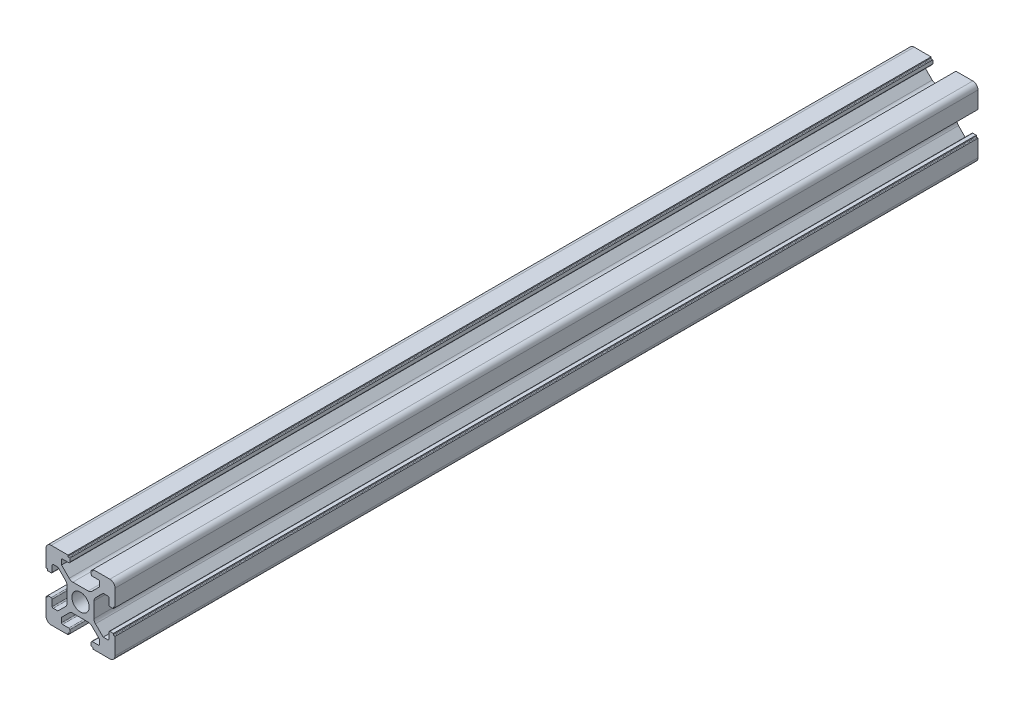
from build123d import *

# Parameters (mm, degrees)
SKETCH_1_R      = 2.5
EXTRUDE_1_DEPTH = 250


with BuildPart() as part:
    # 草图1 → 凸台-拉伸1 (new body)
    with BuildSketch(Plane.XY):
        with BuildLine():
            Line((4.215995631, 3.244230202), (6.436655803, 5.464890373))
            Line((6.436655803, 5.464890373), (7.776655803, 5.464890373))
            ThreePointArc((7.776655803, 5.464890373), (7.988787838, 5.377022408), (8.076655803, 5.164890373))
            Line((8.076655803, 5.164890373), (8.076655803, 3.364890373))
            ThreePointArc((8.076655803, 3.364890373), (8.164523769, 3.152758339), (8.376655803, 3.064890373))
            Line((8.376655803, 3.064890373), (9.376655803, 3.064890373))
            Line((9.376655803, 3.064890373), (9.376655803, 3.364890373))
            ThreePointArc((9.376655803, 3.364890373), (9.435234447, 3.50631173), (9.576655803, 3.564890373))
            Line((9.576655803, 3.564890373), (9.876655803, 3.564890373))
            Line((9.876655803, 3.564890373), (9.876655803, 8.464890373))
            ThreePointArc((9.876655803, 8.464890373), (9.437315975, 9.525550545), (8.376655803, 9.964890373))
            Line((8.376655803, 9.964890373), (3.476655803, 9.964890373))
            Line((3.476655803, 9.964890373), (3.476655803, 9.664890373))
            ThreePointArc((3.476655803, 9.664890373), (3.418077159, 9.523469017), (3.276655803, 9.464890373))
            Line((3.276655803, 9.464890373), (2.976655803, 9.464890373))
            Line((2.976655803, 9.464890373), (2.976655803, 8.464890373))
            ThreePointArc((2.976655803, 8.464890373), (3.064523769, 8.252758339), (3.276655803, 8.164890373))
            Line((3.276655803, 8.164890373), (5.076655803, 8.164890373))
            ThreePointArc((5.076655803, 8.164890373), (5.288787838, 8.077022408), (5.376655803, 7.864890373))
            Line((5.376655803, 7.864890373), (5.376655803, 6.524890373))
            Line((5.376655803, 6.524890373), (3.155995631, 4.304230202))
            ThreePointArc((3.155995631, 4.304230202), (2.669360608, 3.979071075), (2.09533546, 3.864890373))
            Line((2.09533546, 3.864890373), (-2.342023853, 3.864890373))
            ThreePointArc((-2.342023853, 3.864890373), (-2.916049002, 3.979071075), (-3.402684025, 4.304230202))
            Line((-3.402684025, 4.304230202), (-5.623344197, 6.524890373))
            Line((-5.623344197, 6.524890373), (-5.623344197, 7.864890373))
            ThreePointArc((-5.623344197, 7.864890373), (-5.535476231, 8.077022408), (-5.323344197, 8.164890373))
            Line((-5.323344197, 8.164890373), (-3.523344197, 8.164890373))
            ThreePointArc((-3.523344197, 8.164890373), (-3.311212162, 8.252758339), (-3.223344197, 8.464890373))
            Line((-3.223344197, 8.464890373), (-3.223344197, 9.464890373))
            Line((-3.223344197, 9.464890373), (-3.523344197, 9.464890373))
            ThreePointArc((-3.523344197, 9.464890373), (-3.664765553, 9.523469017), (-3.723344197, 9.664890373))
            Line((-3.723344197, 9.664890373), (-3.723344197, 9.964890373))
            Line((-3.723344197, 9.964890373), (-8.623344197, 9.964890373))
            ThreePointArc((-8.623344197, 9.964890373), (-9.684004369, 9.525550545), (-10.123344197, 8.464890373))
            Line((-10.123344197, 8.464890373), (-10.123344197, 3.564890373))
            Line((-10.123344197, 3.564890373), (-9.823344197, 3.564890373))
            ThreePointArc((-9.823344197, 3.564890373), (-9.681922841, 3.50631173), (-9.623344197, 3.364890373))
            Line((-9.623344197, 3.364890373), (-9.623344197, 3.064890373))
            Line((-9.623344197, 3.064890373), (-8.623344197, 3.064890373))
            ThreePointArc((-8.623344197, 3.064890373), (-8.411212162, 3.152758339), (-8.323344197, 3.364890373))
            Line((-8.323344197, 3.364890373), (-8.323344197, 5.164890373))
            ThreePointArc((-8.323344197, 5.164890373), (-8.235476231, 5.377022408), (-8.023344197, 5.464890373))
            Line((-8.023344197, 5.464890373), (-6.683344197, 5.464890373))
            Line((-6.683344197, 5.464890373), (-4.462684025, 3.244230202))
            ThreePointArc((-4.462684025, 3.244230202), (-4.137524898, 2.757595178), (-4.023344197, 2.18357003))
            Line((-4.023344197, 2.18357003), (-4.023344197, -2.253789283))
            ThreePointArc((-4.023344197, -2.253789283), (-4.137524898, -2.827814432), (-4.462684025, -3.314449455))
            Line((-4.462684025, -3.314449455), (-6.683344197, -5.535109627))
            Line((-6.683344197, -5.535109627), (-8.023344197, -5.535109627))
            ThreePointArc((-8.023344197, -5.535109627), (-8.235476231, -5.447241661), (-8.323344197, -5.235109627))
            Line((-8.323344197, -5.235109627), (-8.323344197, -3.435109627))
            ThreePointArc((-8.323344197, -3.435109627), (-8.411212162, -3.222977592), (-8.623344197, -3.135109627))
            Line((-8.623344197, -3.135109627), (-9.623344197, -3.135109627))
            Line((-9.623344197, -3.135109627), (-9.623344197, -3.435109627))
            ThreePointArc((-9.623344197, -3.435109627), (-9.681922841, -3.576530983), (-9.823344197, -3.635109627))
            Line((-9.823344197, -3.635109627), (-10.123344197, -3.635109627))
            Line((-10.123344197, -3.635109627), (-10.123344197, -8.535109627))
            ThreePointArc((-10.123344197, -8.535109627), (-9.684004369, -9.595769798), (-8.623344197, -10.035109627))
            Line((-8.623344197, -10.035109627), (-3.723344197, -10.035109627))
            Line((-3.723344197, -10.035109627), (-3.723344197, -9.735109627))
            ThreePointArc((-3.723344197, -9.735109627), (-3.664765553, -9.59368827), (-3.523344197, -9.535109627))
            Line((-3.523344197, -9.535109627), (-3.223344197, -9.535109627))
            Line((-3.223344197, -9.535109627), (-3.223344197, -8.535109627))
            ThreePointArc((-3.223344197, -8.535109627), (-3.311212162, -8.322977592), (-3.523344197, -8.235109627))
            Line((-3.523344197, -8.235109627), (-5.323344197, -8.235109627))
            ThreePointArc((-5.323344197, -8.235109627), (-5.535476231, -8.147241661), (-5.623344197, -7.935109627))
            Line((-5.623344197, -7.935109627), (-5.623344197, -6.595109627))
            Line((-5.623344197, -6.595109627), (-3.402684025, -4.374449455))
            ThreePointArc((-3.402684025, -4.374449455), (-2.916049002, -4.049290328), (-2.342023853, -3.935109627))
            Line((-2.342023853, -3.935109627), (2.09533546, -3.935109627))
            ThreePointArc((2.09533546, -3.935109627), (2.669360608, -4.049290328), (3.155995631, -4.374449455))
            Line((3.155995631, -4.374449455), (5.376655803, -6.595109627))
            Line((5.376655803, -6.595109627), (5.376655803, -7.935109627))
            ThreePointArc((5.376655803, -7.935109627), (5.288787838, -8.147241661), (5.076655803, -8.235109627))
            Line((5.076655803, -8.235109627), (3.276655803, -8.235109627))
            ThreePointArc((3.276655803, -8.235109627), (3.064523769, -8.322977592), (2.976655803, -8.535109627))
            Line((2.976655803, -8.535109627), (2.976655803, -9.535109627))
            Line((2.976655803, -9.535109627), (3.276655803, -9.535109627))
            ThreePointArc((3.276655803, -9.535109627), (3.418077159, -9.59368827), (3.476655803, -9.735109627))
            Line((3.476655803, -9.735109627), (3.476655803, -10.035109627))
            Line((3.476655803, -10.035109627), (8.376655803, -10.035109627))
            ThreePointArc((8.376655803, -10.035109627), (9.437315975, -9.595769798), (9.876655803, -8.535109627))
            Line((9.876655803, -8.535109627), (9.876655803, -3.635109627))
            Line((9.876655803, -3.635109627), (9.576655803, -3.635109627))
            ThreePointArc((9.576655803, -3.635109627), (9.435234447, -3.576530983), (9.376655803, -3.435109627))
            Line((9.376655803, -3.435109627), (9.376655803, -3.135109627))
            Line((9.376655803, -3.135109627), (8.376655803, -3.135109627))
            ThreePointArc((8.376655803, -3.135109627), (8.164523769, -3.222977592), (8.076655803, -3.435109627))
            Line((8.076655803, -3.435109627), (8.076655803, -5.235109627))
            ThreePointArc((8.076655803, -5.235109627), (7.988787838, -5.447241661), (7.776655803, -5.535109627))
            Line((7.776655803, -5.535109627), (6.436655803, -5.535109627))
            Line((6.436655803, -5.535109627), (4.215995631, -3.314449455))
            ThreePointArc((4.215995631, -3.314449455), (3.890836504, -2.827814432), (3.776655803, -2.253789283))
            Line((3.776655803, -2.253789283), (3.776655803, 2.18357003))
            ThreePointArc((3.776655803, 2.18357003), (3.890836504, 2.757595178), (4.215995631, 3.244230202))
        make_face()
        with Locations((-0.123344197, -0.035109627)):
            Circle(SKETCH_1_R, mode=Mode.SUBTRACT)
    extrude(amount=EXTRUDE_1_DEPTH)


solid = part.part
